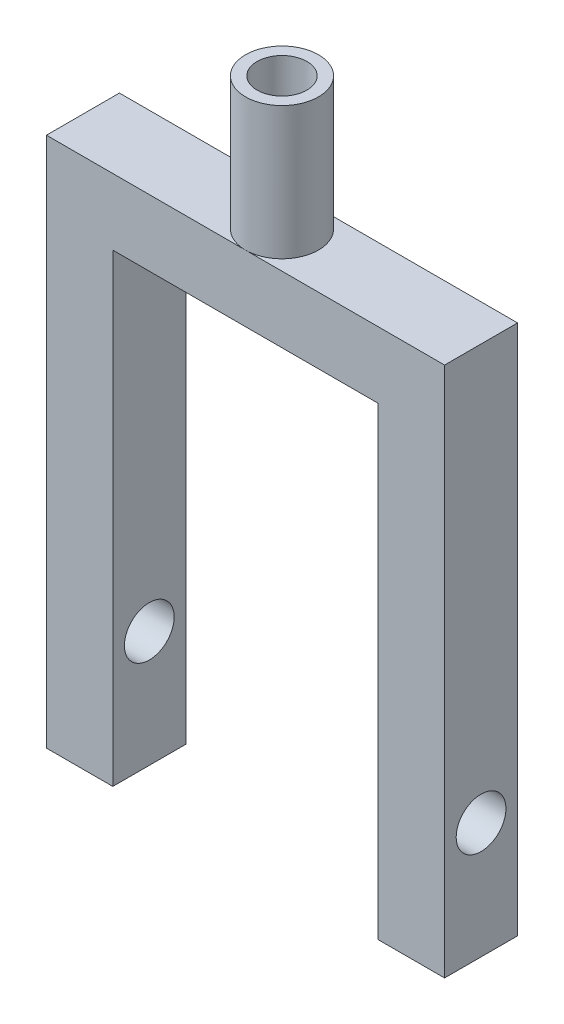
from build123d import *

# Parameters (mm, degrees)
SKETCH1_R               = 6.985
BOSS_EXTRUDE1_DEPTH     = 25.4
SKETCH3_R               = 4.7625
CUT_EXTRUDE1_DEPTH      = 63.5
SKETCH5_W               = 76.2
SKETCH5_H               = 13.97
BOSS_EXTRUDE2_DEPTH     = 101.6
SKETCH6_W               = 50.8
SKETCH6_H               = 88.9
CUT_EXTRUDE2_DEPTH      = 134.325807329
SKETCH7_R               = 4.7625
CUT_EXTRUDE3_DEPTH      = 133.775751645
CUT_EXTRUDE4_DEPTH      = 143.162021036
CUT_EXTRUDE4_DEPTH_BACK = 19.05
SKETCH8_R               = 4.7625


with BuildPart() as part:
    # Sketch1 → Boss-Extrude1 (new body)
    with BuildSketch(Plane(origin=(0, 0, 0), x_dir=(1, 0, 0), z_dir=(0, 1, 0))):
        with Locations(Location((0, 0, 0), (0, 0, 270))):
            Circle(SKETCH1_R)
    extrude(amount=-BOSS_EXTRUDE1_DEPTH)

    # Sketch3 → Cut-Extrude1 (cut)
    with BuildSketch(Plane(origin=(0, 0, 0), x_dir=(1, 0, 0), z_dir=(0, 1, 0))):
        with Locations(Location((0, 0, 0), (0, 0, 270))):
            Circle(SKETCH3_R)
    extrude(amount=-CUT_EXTRUDE1_DEPTH, mode=Mode.SUBTRACT)

    # Sketch5 → Boss-Extrude2 (add)
    with BuildSketch(Plane(origin=(0, -25.4, 0), x_dir=(-1, 0, 0), z_dir=(0, -1, 0))):
        Rectangle(SKETCH5_W, SKETCH5_H)
    extrude(amount=BOSS_EXTRUDE2_DEPTH)

    # Sketch6 → Cut-Extrude2 (cut, through all)
    with BuildSketch(Plane(origin=(0, 0, -6.985), x_dir=(-1, 0, 0), z_dir=(0, 0, -1))):
        with Locations((0, -82.55)):
            Rectangle(SKETCH6_W, SKETCH6_H)
    extrude(amount=-CUT_EXTRUDE2_DEPTH, mode=Mode.SUBTRACT)

    # Sketch7 → Cut-Extrude3 (cut, through all)
    with BuildSketch(Plane(origin=(0, 0, 0), x_dir=(1, 0, 0), z_dir=(0, 1, 0))):
        with Locations(Location((0, 0, 0), (0, 0, 270))):
            Circle(SKETCH7_R)
    extrude(amount=-CUT_EXTRUDE3_DEPTH, mode=Mode.SUBTRACT)

    # Sketch8 → Cut-Extrude4 (cut, two sides: drawn at the far end of the back side and taken through both)
    with BuildSketch(Plane.ZY.offset(-25.4).offset(-CUT_EXTRUDE4_DEPTH_BACK)):
        with Locations((0, -104.775)):
            Circle(SKETCH8_R)
    extrude(amount=CUT_EXTRUDE4_DEPTH + CUT_EXTRUDE4_DEPTH_BACK, mode=Mode.SUBTRACT)


solid = part.part
